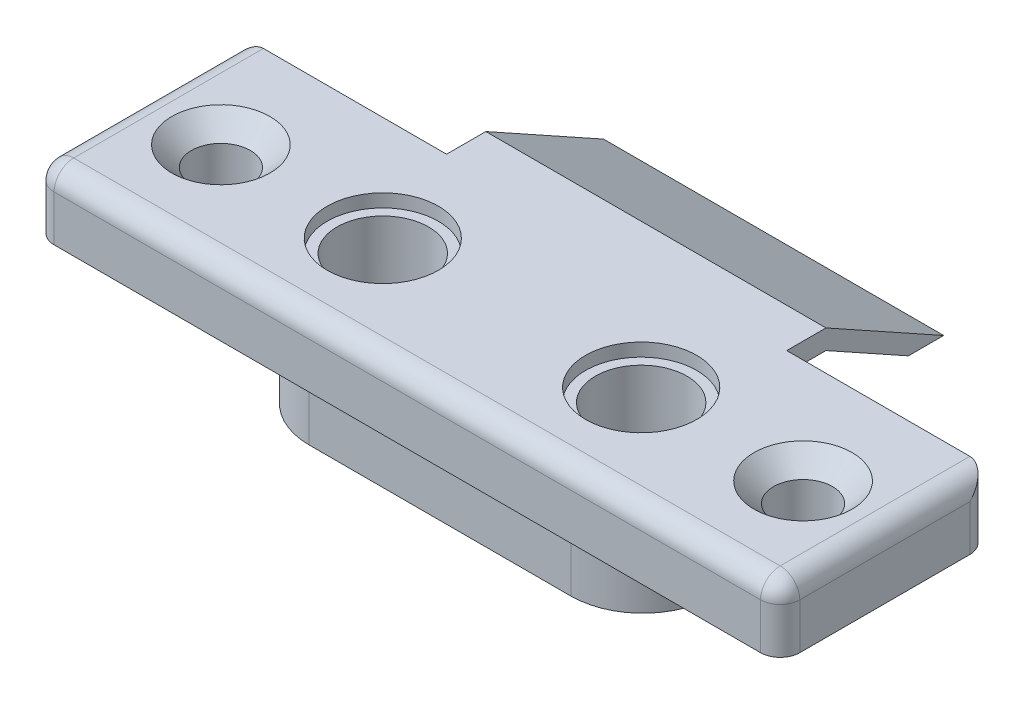
from build123d import *

# Parameters (mm, degrees)
SKETCH_1_W           = 57
SKETCH_1_H           = 16
EXTRUDE_1_DEPTH      = 5
FILLET_1_R           = 1.5
HOLE_WIZARD_M41_D    = 4.5
CHAMFER_1_SIZE       = 1.5
SKETCH_2_R           = 4.25
CUT_EXTRUDE_1_DEPTH  = 1
SKETCH_7_R           = 3.5
CUT_EXTRUDE_2_DEPTH  = 60.338014797
EXTRUDE_2_DEPTH      = 13
EXTRUDE_2_DEPTH_BACK = 13
SKETCH_10_R          = 3.5
EXTRUDE_3_DEPTH      = 6
SKETCH_11_R          = 2.25
CUT_EXTRUDE_3_DEPTH  = 9.25
EXTRUDE_START        = 0.1
SKETCH_12_R          = 4
SKETCH_12_R_2        = 2.25
EXTRUDE_4_DEPTH      = 0.1
SKETCH_13_R          = 1.75
CUT_EXTRUDE_4_DEPTH  = 5


with BuildPart() as part:
    # Эскиз1 → Бобышка-Вытянуть1 (new body)
    with BuildSketch(Plane(origin=(0, 0, 0), x_dir=(1, 0, 0), z_dir=(0, 1, 0))):
        with Locations((28.5, 8)):
            Rectangle(SKETCH_1_W, SKETCH_1_H)
    extrude(amount=EXTRUDE_1_DEPTH)

    # Скругление1
    fillet_1_edges = [part.edges().sort_by_distance(p)[0] for p in [
        (0, 5, -8),
        (28.5, 5, 0),
        (57, 5, -8),
        (0, 2.5, 0),
        (0, 2.5, -16),
        (57, 2.5, -16),
        (57, 2.5, 0),
    ]]
    fillet(fillet_1_edges, radius=FILLET_1_R)

    # Отверстие с зазором M41 (through all)
    with Locations(Plane(origin=(0, 5, 0), x_dir=(1, 0, 0), z_dir=(0, 1, 0))):
        with Locations((6.25, 8), (50.75, 8)):
            Hole(HOLE_WIZARD_M41_D / 2)

    # Фаска1
    chamfer_1_edges = [part.edges().sort_by_distance(p)[0] for p in [
        (53, 5, -8),
        (8.5, 5, -8),
    ]]
    chamfer(chamfer_1_edges, length=CHAMFER_1_SIZE)

    # Эскиз2 → Вырез-Вытянуть1 (cut)
    with BuildSketch(Plane(origin=(0, 5, 0), x_dir=(1, 0, 0), z_dir=(0, 1, 0))):
        with Locations(Location((18.625, 8, 0), (0, 0, 270))):
            Circle(SKETCH_2_R)
        with Locations(Location((38.375, 8, 0), (0, 0, 270))):
            Circle(SKETCH_2_R)
    extrude(amount=-CUT_EXTRUDE_1_DEPTH, mode=Mode.SUBTRACT)

    # Эскиз7 → Вырез-Вытянуть2 (cut, through all)
    with BuildSketch(Plane(origin=(0, 4, 0), x_dir=(1, 0, 0), z_dir=(0, 1, 0))):
        with Locations(Location((18.625, 8, 0), (0, 0, 270))):
            Circle(SKETCH_7_R)
        with Locations(Location((38.375, 8, 0), (0, 0, 270))):
            Circle(SKETCH_7_R)
    extrude(amount=-CUT_EXTRUDE_2_DEPTH, mode=Mode.SUBTRACT)

    # Эскиз9 → Бобышка-Вытянуть2 (add, two sides: drawn at the far end of the back side and taken through both)
    with BuildSketch(Plane.ZY.offset(-28.5).offset(-EXTRUDE_2_DEPTH_BACK)):
        Polygon((-19, 5), (-28, 0), (-25.3, 0), (-19, 3.5), (-16, 3.5), (-16, 5), align=None)
    extrude(amount=EXTRUDE_2_DEPTH + EXTRUDE_2_DEPTH_BACK)

    # Эскиз10 → Бобышка-Вытянуть3 (add)
    with BuildSketch(Plane.XZ):
        with BuildLine():
            Line((18.5, -13.5), (38.5, -13.5))
            ThreePointArc((38.5, -13.5), (44, -8), (38.5, -2.5))
            Line((38.5, -2.5), (18.5, -2.5))
            ThreePointArc((18.5, -2.5), (13, -8), (18.5, -13.5))
        make_face()
        with Locations(Location((38.375, -8, 0), (0, 0, 90))):
            Circle(SKETCH_10_R, mode=Mode.SUBTRACT)
        with Locations(Location((18.625, -8, 0), (0, 0, 90))):
            Circle(SKETCH_10_R, mode=Mode.SUBTRACT)
    extrude(amount=EXTRUDE_3_DEPTH)

    # Эскиз11 → Вырез-Вытянуть3 (cut)
    with BuildSketch(Plane.XZ.offset(6)):
        with Locations(Location((28.5, -8, 0), (0, 0, 270))):
            Circle(SKETCH_11_R)
    extrude(amount=-CUT_EXTRUDE_3_DEPTH, mode=Mode.SUBTRACT)

    # Эскиз12 → Бобышка-Вытянуть4 (add)
    with BuildSketch(Plane.XZ.offset(6).offset(EXTRUDE_START)):
        with Locations(Location((28.5, -8, 0), (0, 0, 270))):
            Circle(SKETCH_12_R)
        with Locations(Location((28.5, -8, 0), (0, 0, 270))):
            Circle(SKETCH_12_R_2, mode=Mode.SUBTRACT)
    extrude(amount=-EXTRUDE_4_DEPTH)

    # Эскиз13 → Вырез-Вытянуть4 (cut)
    with BuildSketch(Plane(origin=(0, 0, -13.5), x_dir=(-1, 0, 0), z_dir=(0, 0, -1))):
        with Locations((-38.375, -3)):
            Circle(SKETCH_13_R)
        with Locations((-18.625, -3)):
            Circle(SKETCH_13_R)
    extrude(amount=-CUT_EXTRUDE_4_DEPTH, mode=Mode.SUBTRACT)


solid = part.part
